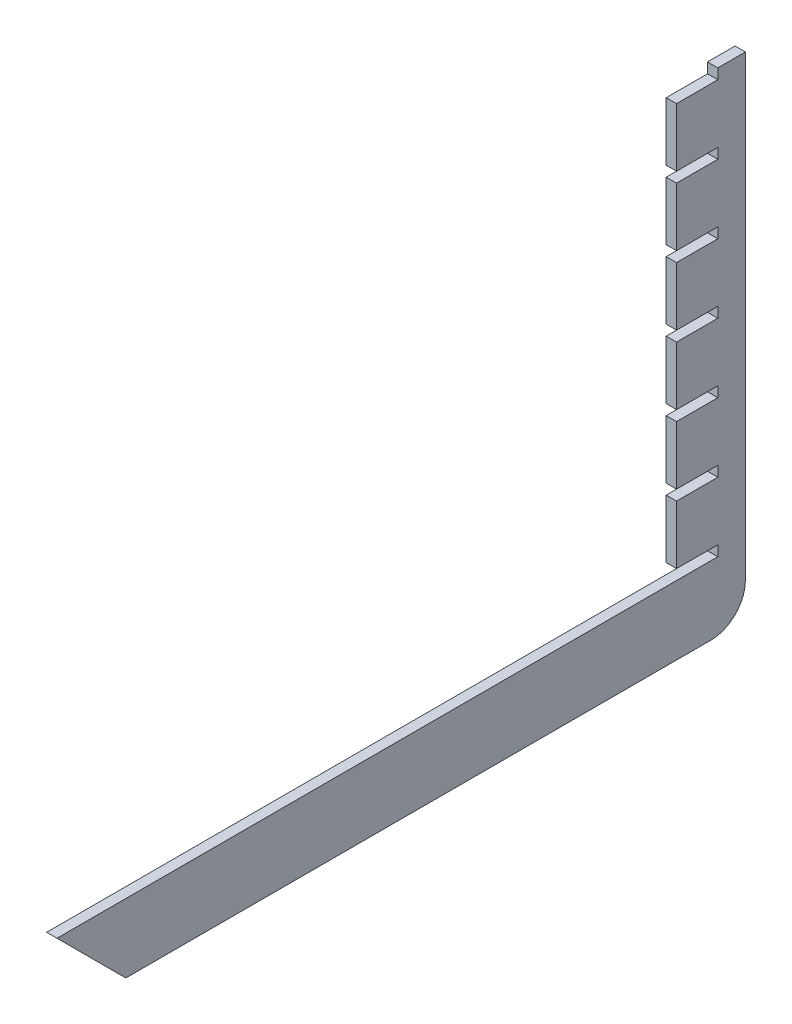
from build123d import *

# Parameters (mm, degrees)
SKETCH1_W           = 20
SKETCH1_H           = 123
BOSS_EXTRUDE1_DEPTH = 3
SKETCH2_W           = 12
SKETCH2_H           = 3
CUT_EXTRUDE1_DEPTH  = 125.651514231
LPATTERN1_COUNT     = 7
LPATTERN1_PITCH     = 20
BOSS_EXTRUDE2_DEPTH = 3
FILLET1_R           = 10


with BuildPart() as part:
    # Sketch1 → Boss-Extrude1 (new body)
    with BuildSketch(Plane(origin=(0, 0, 0), x_dir=(0, 0, -1), z_dir=(1, 0, 0))):
        with Locations((10, 61.5)):
            Rectangle(SKETCH1_W, SKETCH1_H)
    extrude(amount=BOSS_EXTRUDE1_DEPTH)

    # Sketch2 → Cut-Extrude1 (cut, through all)
    with BuildSketch(Plane(origin=(3, 0, 0), x_dir=(0, 0, -1), z_dir=(1, 0, 0))):
        with Locations((6, 1.5)):
            Rectangle(SKETCH2_W, SKETCH2_H)
    cut_extrude1 = extrude(amount=-CUT_EXTRUDE1_DEPTH, mode=Mode.SUBTRACT)

    # LPattern1: Cut-Extrude1 ×7
    with Locations(*[(0, i * LPATTERN1_PITCH, 0) for i in range(1, LPATTERN1_COUNT)]):
        add(cut_extrude1, mode=Mode.SUBTRACT)

    # Sketch3 → Boss-Extrude2 (add)
    with BuildSketch(Plane.ZY):
        Polygon((180, 0), (160, -20), (-20, -20), (-20, 0), align=None)
    extrude(amount=-BOSS_EXTRUDE2_DEPTH)

    # Fillet1
    fillet1_edges = [part.edges().sort_by_distance(p)[0] for p in [
        (1.5, -20, -20),
    ]]
    fillet(fillet1_edges, radius=FILLET1_R)


solid = part.part
